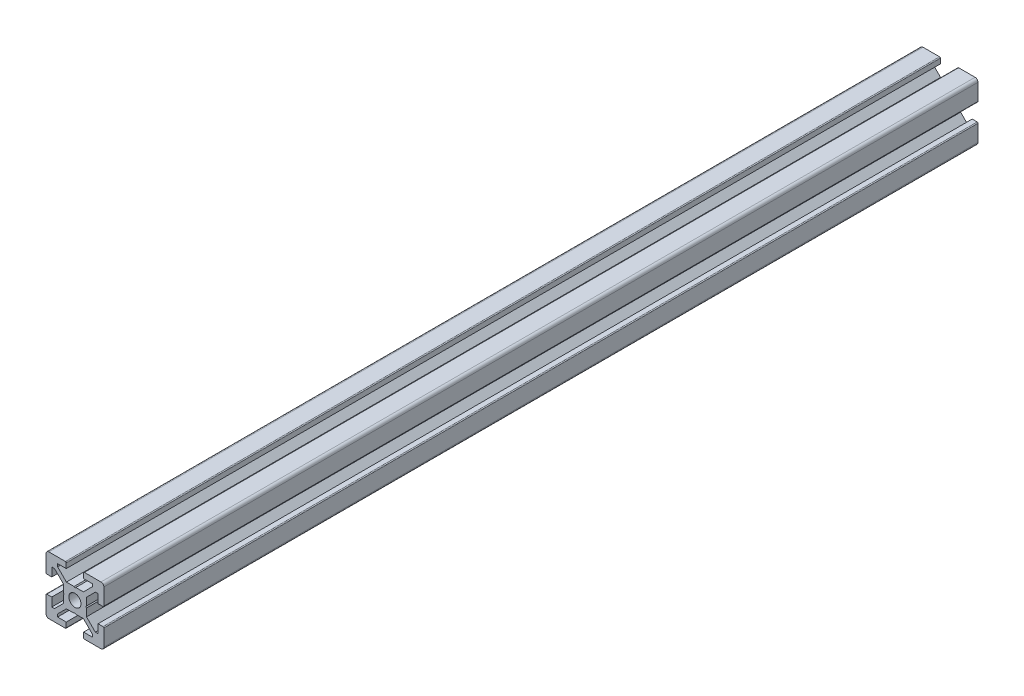
from build123d import *

# Parameters (mm, degrees)
SKETCH1_R           = 2.1
BOSS_EXTRUDE1_DEPTH = 151.1


with BuildPart() as part:
    # Sketch1 → Boss-Extrude1 (new, symmetric)
    with BuildSketch(Plane(origin=(0, 0, 0), x_dir=(-1, 0, 0), z_dir=(0, 0, -1))):
        with BuildLine():
            Line((10, 3.3), (10, 9))
            ThreePointArc((10, 9), (9.707106781, 9.707106781), (9, 10))
            Line((9, 10), (3.3, 10))
            ThreePointArc((3.3, 10), (3.087867966, 9.912132034), (3, 9.7))
            Line((3, 9.7), (3, 8))
            Line((3, 8), (6, 8))
            Line((6, 8), (6, 7.060660172))
            Line((6, 7.060660172), (2.939339828, 4))
            Line((2.939339828, 4), (0.3, 4))
            Line((0.3, 4), (0, 3.7))
            Line((0, 3.7), (-0.3, 4))
            Line((-0.3, 4), (-2.939339828, 4))
            Line((-2.939339828, 4), (-6, 7.060660172))
            Line((-6, 7.060660172), (-6, 8))
            Line((-6, 8), (-3, 8))
            Line((-3, 8), (-3, 9.7))
            ThreePointArc((-3, 9.7), (-3.087867966, 9.912132034), (-3.3, 10))
            Line((-3.3, 10), (-9, 10))
            ThreePointArc((-9, 10), (-9.707106781, 9.707106781), (-10, 9))
            Line((-10, 9), (-10, 3.3))
            ThreePointArc((-10, 3.3), (-9.912132034, 3.087867966), (-9.7, 3))
            Line((-9.7, 3), (-8, 3))
            Line((-8, 3), (-8, 6))
            Line((-8, 6), (-7.060660172, 6))
            Line((-7.060660172, 6), (-4, 2.939339828))
            Line((-4, 2.939339828), (-4, 0.3))
            Line((-4, 0.3), (-3.7, 0))
            Line((-3.7, 0), (-4, -0.3))
            Line((-4, -0.3), (-4, -2.939339828))
            Line((-4, -2.939339828), (-7.060660172, -6))
            Line((-7.060660172, -6), (-8, -6))
            Line((-8, -6), (-8, -3))
            Line((-8, -3), (-9.7, -3))
            ThreePointArc((-9.7, -3), (-9.912132034, -3.087867966), (-10, -3.3))
            Line((-10, -3.3), (-10, -9))
            ThreePointArc((-10, -9), (-9.707106781, -9.707106781), (-9, -10))
            Line((-9, -10), (-3.3, -10))
            ThreePointArc((-3.3, -10), (-3.087867966, -9.912132034), (-3, -9.7))
            Line((-3, -9.7), (-3, -8))
            Line((-3, -8), (-6, -8))
            Line((-6, -8), (-6, -7.060660172))
            Line((-6, -7.060660172), (-2.939339828, -4))
            Line((-2.939339828, -4), (-0.3, -4))
            Line((-0.3, -4), (0, -3.7))
            Line((0, -3.7), (0.3, -4))
            Line((0.3, -4), (2.939339828, -4))
            Line((2.939339828, -4), (6, -7.060660172))
            Line((6, -7.060660172), (6, -8))
            Line((6, -8), (3, -8))
            Line((3, -8), (3, -9.7))
            ThreePointArc((3, -9.7), (3.087867966, -9.912132034), (3.3, -10))
            Line((3.3, -10), (9, -10))
            ThreePointArc((9, -10), (9.707106781, -9.707106781), (10, -9))
            Line((10, -9), (10, -3.3))
            ThreePointArc((10, -3.3), (9.912132034, -3.087867966), (9.7, -3))
            Line((9.7, -3), (8, -3))
            Line((8, -3), (8, -6))
            Line((8, -6), (7.060660172, -6))
            Line((7.060660172, -6), (4, -2.939339828))
            Line((4, -2.939339828), (4, -0.3))
            Line((4, -0.3), (3.7, 0))
            Line((3.7, 0), (4, 0.3))
            Line((4, 0.3), (4, 2.939339828))
            Line((4, 2.939339828), (7.060660172, 6))
            Line((7.060660172, 6), (8, 6))
            Line((8, 6), (8, 3))
            Line((8, 3), (9.7, 3))
            ThreePointArc((9.7, 3), (9.912132034, 3.087867966), (10, 3.3))
        make_face()
        Circle(SKETCH1_R, mode=Mode.SUBTRACT)
    extrude(amount=BOSS_EXTRUDE1_DEPTH, both=True)


solid = part.part
